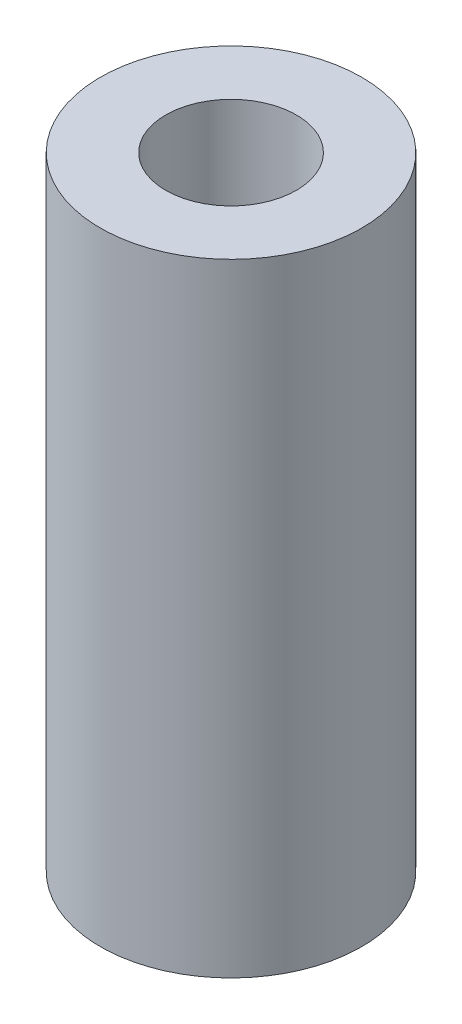
from build123d import *

# Parameters (mm, degrees)
SKETCH2_R           = 4
BOSS_EXTRUDE2_DEPTH = 9.525
SKETCH3_R           = 2
CUT_EXTRUDE1_DEPTH  = 6.35


with BuildPart() as part:
    # Sketch2 → Boss-Extrude2 (new, symmetric)
    with BuildSketch(Plane(origin=(0, 0, 0), x_dir=(1, 0, 0), z_dir=(0, 1, 0))):
        with Locations(Location((0, 0, 0), (0, 0, 90))):
            Circle(SKETCH2_R)
    extrude(amount=BOSS_EXTRUDE2_DEPTH, both=True)

    # Sketch3 → Cut-Extrude1 (cut)
    with BuildSketch(Plane(origin=(0, 9.525, 0), x_dir=(1, 0, 0), z_dir=(0, 1, 0))):
        with Locations(Location((0, 0, 0), (0, 0, 270))):
            Circle(SKETCH3_R)
    cut_extrude1 = extrude(amount=-CUT_EXTRUDE1_DEPTH, mode=Mode.SUBTRACT)

    # Mirror1: Cut-Extrude1 across plane
    add(cut_extrude1.mirror(Plane.ZX), mode=Mode.SUBTRACT)


solid = part.part
